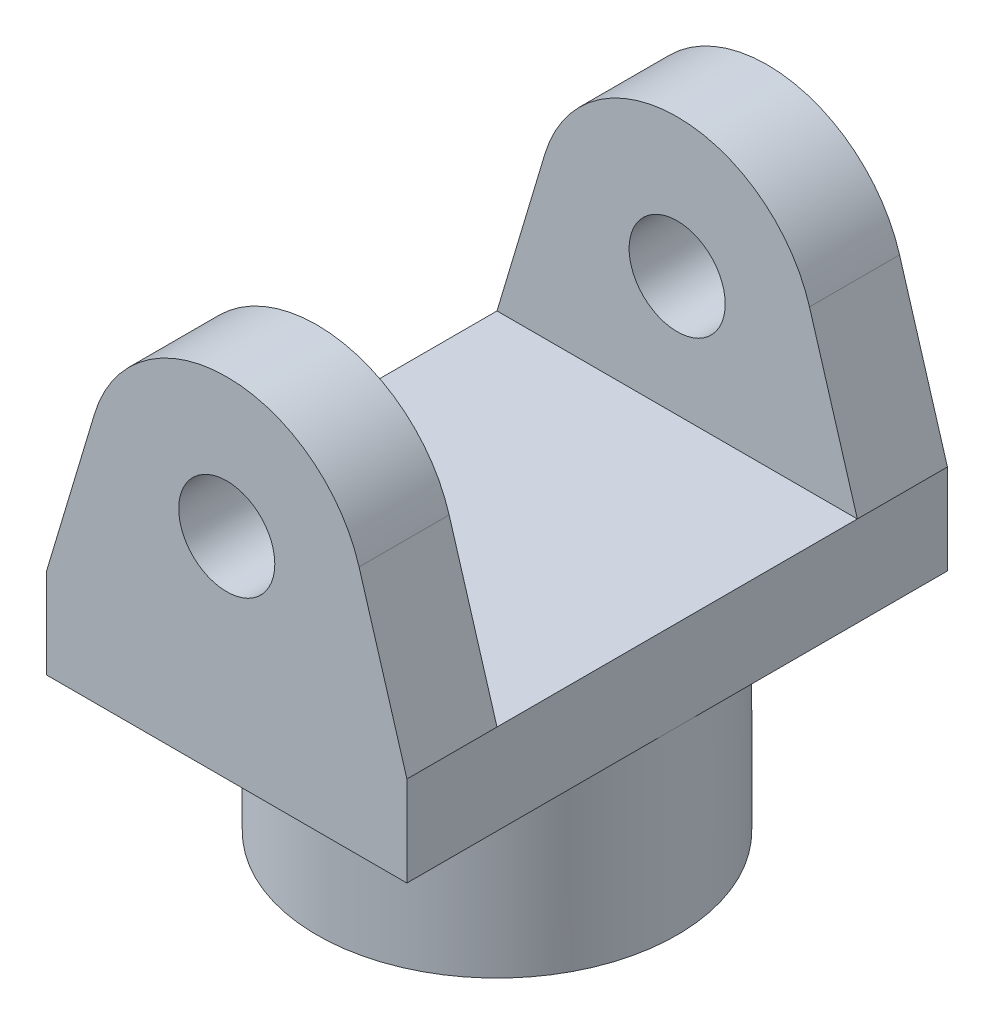
from build123d import *

# Parameters (mm, degrees)
SKETCH1_W           = 60
SKETCH1_H           = 15
BOSS_EXTRUDE1_DEPTH = 90
SKETCH1_3_R         = 8
BOSS_EXTRUDE2_DEPTH = 15
SKETCH2_R           = 30
BOSS_EXTRUDE3_DEPTH = 30


with BuildPart() as part:
    # Sketch1 → Boss-Extrude1 (new body)
    with BuildSketch(Plane.XY):
        with Locations((0, -27.5)):
            Rectangle(SKETCH1_W, SKETCH1_H)
    extrude(amount=BOSS_EXTRUDE1_DEPTH)

    # Sketch1<3> → Boss-Extrude2 (add)
    with BuildSketch(Plane.XY):
        with BuildLine():
            ThreePointArc((22.03289839, 6.599347585), (0, 23), (-22.03289839, 6.599347585))
            Line((-22.03289839, 6.599347585), (-30, -20))
            Line((-30, -20), (30, -20))
            Line((30, -20), (22.03289839, 6.599347585))
        make_face()
        Circle(SKETCH1_3_R, mode=Mode.SUBTRACT)
    boss_extrude2 = extrude(amount=BOSS_EXTRUDE2_DEPTH)

    # Mirror1: Boss-Extrude2 across plane
    add(boss_extrude2.mirror(Plane.XY.offset(45)))

    # Sketch2 → Boss-Extrude3 (add)
    with BuildSketch(Plane.XZ.offset(35)):
        with Locations((0, 45)):
            Circle(SKETCH2_R)
        with BuildLine():
            Line((-2, 59.866068747), (-2, 65.866068747))
            Line((-2, 65.866068747), (2, 65.866068747))
            Line((2, 65.866068747), (2, 59.866068747))
            ThreePointArc((2, 59.866068747), (0, 30), (-2, 59.866068747))
        make_face(mode=Mode.SUBTRACT)
    extrude(amount=BOSS_EXTRUDE3_DEPTH)


solid = part.part
